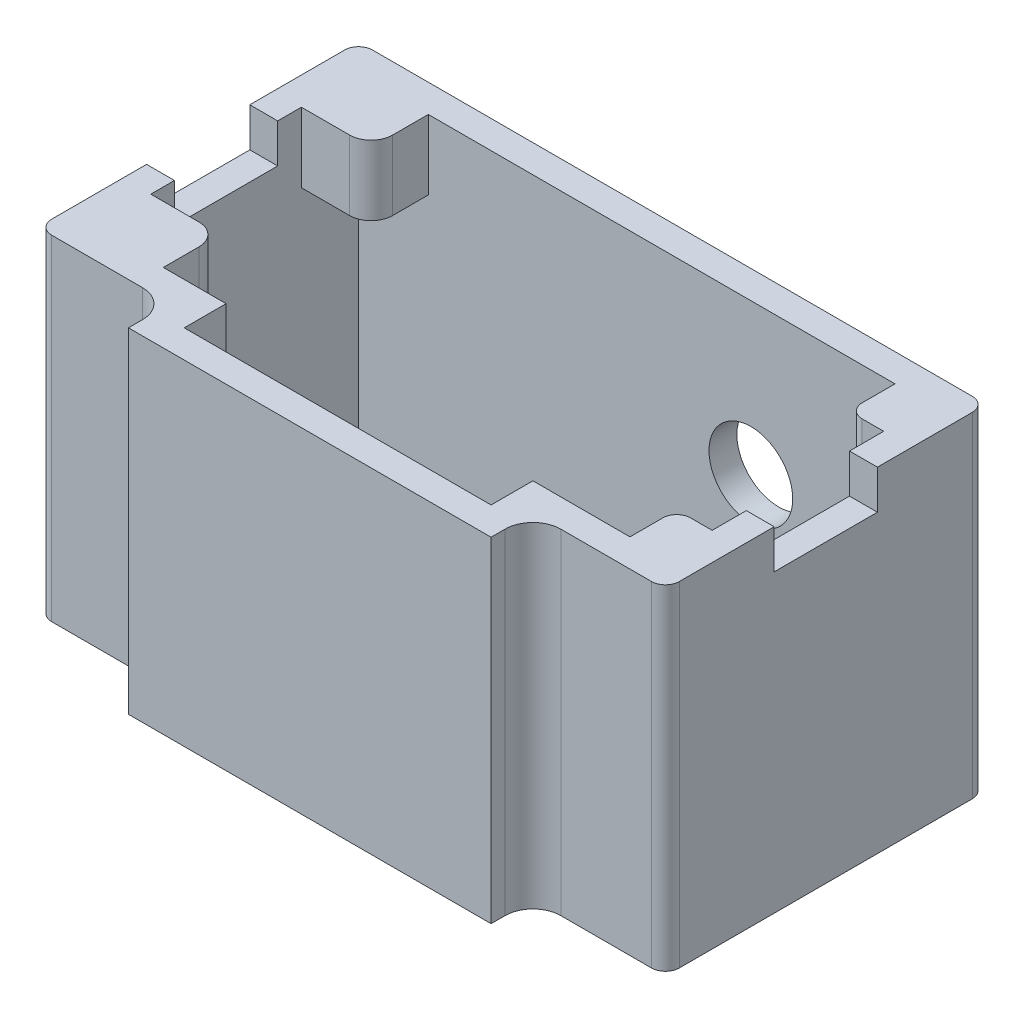
from build123d import *

# Parameters (mm, degrees)
SKETCH1_W           = 57.15
SKETCH1_H           = 29.21
BOSS_EXTRUDE1_DEPTH = 30.48
SHELL1_T            = -2.54
SKETCH2_W           = 10.668
SKETCH2_H           = 12.954
CUT_EXTRUDE1_DEPTH  = 2.54
BOSS_EXTRUDE2_DEPTH = 6.35
CUT_EXTRUDE2_REACH  = 68.396
SKETCH4_W           = 9.398
SKETCH4_H           = 7.112
SKETCH6_W           = 33.02
SKETCH6_H           = 3.81
BOSS_EXTRUDE3_DEPTH = 30.48
SKETCH7_W           = 27.94
SKETCH7_H           = 3.81
CUT_EXTRUDE3_DEPTH  = 27.94
FILLET1_R           = 2.54
FILLET2_R           = 1.27
SKETCH8_R           = 3.81
CUT_EXTRUDE4_DEPTH  = 2.54


with BuildPart() as part:
    # Sketch1 → Boss-Extrude1 (new body)
    with BuildSketch(Plane(origin=(0, 0, 0), x_dir=(1, 0, 0), z_dir=(0, 1, 0))):
        Rectangle(SKETCH1_W, SKETCH1_H)
    extrude(amount=BOSS_EXTRUDE1_DEPTH)

    # Shell1
    shell1_openings = [part.faces().sort_by_distance(p)[0] for p in [
        (0, 30.48, 0),
    ]]
    offset(amount=SHELL1_T, openings=shell1_openings, kind=Kind.INTERSECTION)

    # Sketch2 → Cut-Extrude1 (cut)
    with BuildSketch(Plane.XZ):
        with Locations((18.796, 0)):
            Rectangle(SKETCH2_W, SKETCH2_H)
    extrude(amount=-CUT_EXTRUDE1_DEPTH, mode=Mode.SUBTRACT)

    # Sketch3 → Boss-Extrude2 (add)
    with BuildSketch(Plane(origin=(0, 30.48, 0), x_dir=(1, 0, 0), z_dir=(0, 1, 0))):
        with BuildLine():
            Line((-26.035, 12.065), (-26.035, 6.858))
            Line((-26.035, 6.858), (-21.6408, 6.858))
            ThreePointArc((-21.6408, 6.858), (-20.257840557, 7.430840557), (-19.685, 8.8138))
            Line((-19.685, 8.8138), (-19.685, 12.065))
            Line((-19.685, 12.065), (-26.035, 12.065))
        make_face()
        with BuildLine():
            Line((-19.685, -12.065), (-19.685, -8.8138))
            ThreePointArc((-19.685, -8.8138), (-20.257840557, -7.430840557), (-21.6408, -6.858))
            Line((-21.6408, -6.858), (-26.035, -6.858))
            Line((-26.035, -6.858), (-26.035, -12.065))
            Line((-26.035, -12.065), (-19.685, -12.065))
        make_face()
        with BuildLine():
            Line((26.035, 12.065), (22.8092, 12.065))
            Line((22.8092, 12.065), (22.8092, 9.0805))
            ThreePointArc((22.8092, 9.0805), (23.181174388, 8.182474388), (24.0792, 7.8105))
            Line((24.0792, 7.8105), (26.035, 7.8105))
            Line((26.035, 7.8105), (26.035, 12.065))
        make_face()
        with BuildLine():
            Line((26.035, -7.8105), (26.035, -12.065))
            Line((26.035, -12.065), (22.8092, -12.065))
            Line((22.8092, -12.065), (22.8092, -9.0805))
            ThreePointArc((22.8092, -9.0805), (23.181174388, -8.182474388), (24.0792, -7.8105))
            Line((24.0792, -7.8105), (26.035, -7.8105))
        make_face()
    extrude(amount=-BOSS_EXTRUDE2_DEPTH)

    # Cut-Extrude2: up to this face of the body (flat: up to its plane)
    cut_extrude2_end = Plane(part.part.faces().sort_by_distance((28.575, 15.24, 0))[0])
    # Sketch4 → Cut-Extrude2 (cut, up to the picked face)
    with BuildSketch(Plane.ZY.offset(28.575), mode=Mode.PRIVATE) as cut_extrude2_sk1:
        with Locations((0, 30.48)):
            Rectangle(SKETCH4_W, SKETCH4_H)
    cut_extrude2_tool1 = split(extrude(cut_extrude2_sk1.sketch, amount=-CUT_EXTRUDE2_REACH, mode=Mode.PRIVATE), bisect_by=cut_extrude2_end, keep=Keep.BOTH, mode=Mode.PRIVATE)
    add(cut_extrude2_tool1.solids().sort_by(Axis((-28.575, 30.48, 0), (1, 0, 0)))[0], mode=Mode.SUBTRACT)

    # Sketch6 → Boss-Extrude3 (add)
    with BuildSketch(Plane(origin=(0, 30.48, 0), x_dir=(1, 0, 0), z_dir=(0, 1, 0))):
        with Locations((0, -16.51)):
            Rectangle(SKETCH6_W, SKETCH6_H)
    extrude(amount=-BOSS_EXTRUDE3_DEPTH)

    # Sketch7 → Cut-Extrude3 (cut)
    with BuildSketch(Plane(origin=(0, 30.48, 0), x_dir=(1, 0, 0), z_dir=(0, 1, 0))):
        with Locations((0, -13.97)):
            Rectangle(SKETCH7_W, SKETCH7_H)
    extrude(amount=-CUT_EXTRUDE3_DEPTH, mode=Mode.SUBTRACT)

    # Fillet1
    fillet1_edges = [part.edges().sort_by_distance(p)[0] for p in [
        (16.51, 15.24, 14.605),
        (-16.51, 15.24, 14.605),
    ]]
    fillet(fillet1_edges, radius=FILLET1_R)

    # Fillet2
    fillet2_edges = [part.edges().sort_by_distance(p)[0] for p in [
        (28.575, 15.24, 14.605),
        (-28.575, 15.24, 14.605),
        (-28.575, 15.24, -14.605),
        (28.575, 15.24, -14.605),
    ]]
    fillet(fillet2_edges, radius=FILLET2_R)

    # Sketch8 → Cut-Extrude4 (cut)
    with BuildSketch(Plane(origin=(0, 0, -14.605), x_dir=(-1, 0, 0), z_dir=(0, 0, -1))):
        with Locations((-9.68413116, 16.745112741)):
            Circle(SKETCH8_R)
    extrude(amount=-CUT_EXTRUDE4_DEPTH, mode=Mode.SUBTRACT)


solid = part.part
